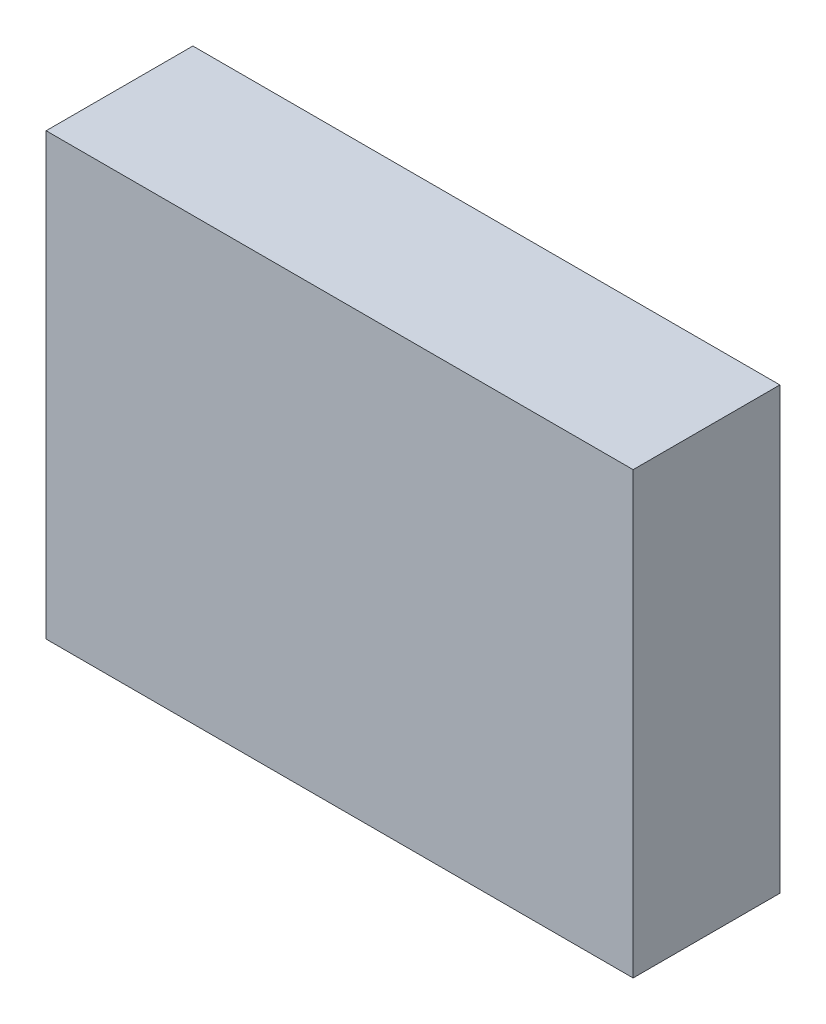
from build123d import *

# Parameters (mm, degrees)
SKETCH_1_W      = 80
SKETCH_1_H      = 60
EXTRUDE_1_DEPTH = 20


with BuildPart() as part:
    # 草图1 → 凸台-拉伸1 (new body)
    with BuildSketch(Plane.XY):
        Rectangle(SKETCH_1_W, SKETCH_1_H)
    extrude(amount=EXTRUDE_1_DEPTH)


solid = part.part
